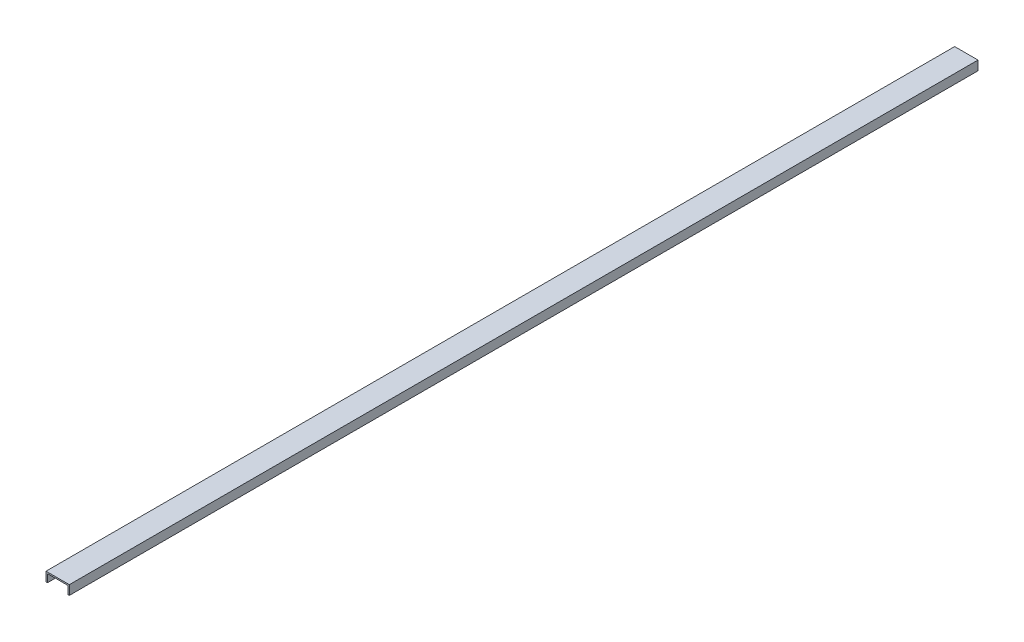
from build123d import *

# Parameters (mm, degrees)
BOSS_EXTRUDE1_DEPTH = 1825
DOWN_DEPTH          = 47
UP_DEPTH            = 75


with BuildPart() as part:
    # Sketch1 → Boss-Extrude1 (new body)
    with BuildSketch(Plane.XY):
        Polygon((0, 0), (0, 20), (50, 20), (50, 0), (47, 0), (47, 17), (3, 17), (3, 0), align=None)
    extrude(amount=BOSS_EXTRUDE1_DEPTH)

    # Sketch2 → Down (add)
    with BuildSketch(Plane.XY.offset(1825)):
        Polygon((0, 0), (0, 20), (50, 20), (50, 0), (47, 0), (47, 17), (3, 17), (3, 0), align=None)
    extrude(amount=DOWN_DEPTH)

    # Sketch3 → Up (add)
    with BuildSketch(Plane(origin=(0, 0, 0), x_dir=(-1, 0, 0), z_dir=(0, 0, -1))):
        Polygon((-50, 0), (-50, 20), (0, 20), (0, 0), (-3, 0), (-3, 17), (-47, 17), (-47, 0), align=None)
    extrude(amount=UP_DEPTH)


solid = part.part
